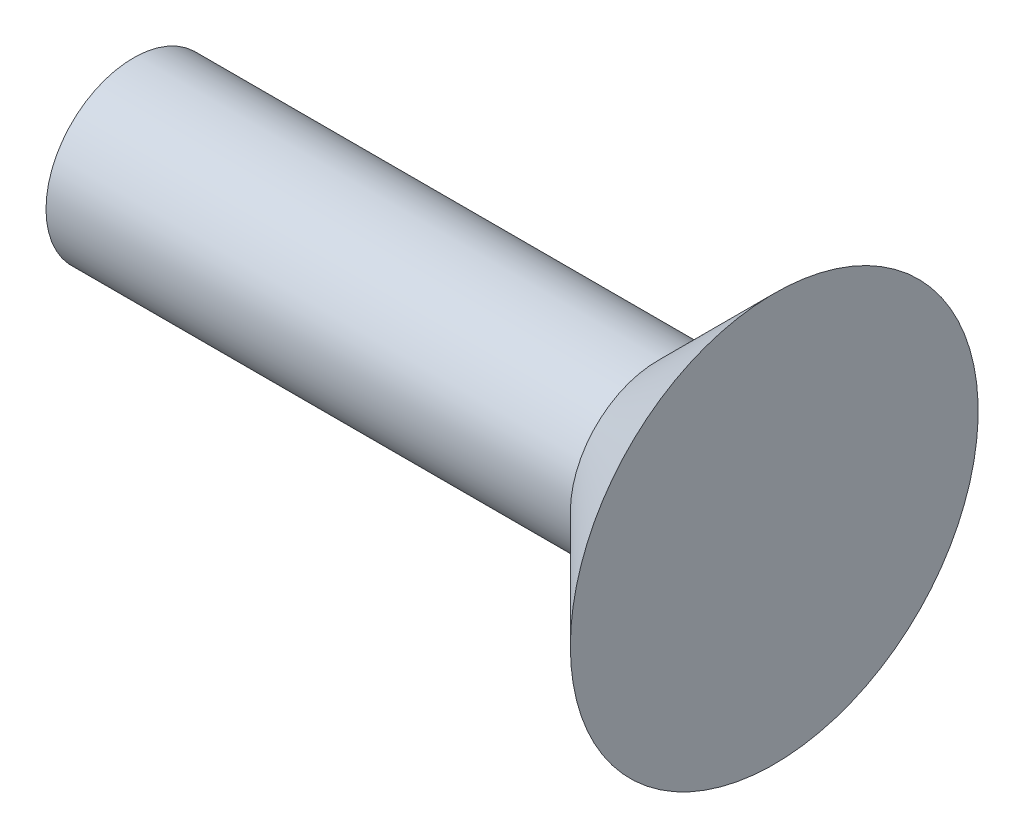
from build123d import *

# Parameters (mm, degrees)
SKETCH2_W          = 4.01503839
SKETCH2_H          = 3.611613481
CUT_EXTRUDE1_DEPTH = 3


with BuildPart() as part:
    # Sketch1 → Revolve2 (revolve)
    with BuildSketch(Plane.XY, mode=Mode.PRIVATE) as revolve2_sk:
        Polygon((-84.003233386, 19.234385214), (-72.003233386, 19.234385214), (-70.003233386, 21.234385214), (-70.003233386, 17.734385214), (-84.003233386, 17.734385214), align=None)
    revolve(revolve2_sk.sketch.rotate(Axis((-84.003233386, 17.734385214, 0), (1, 0, 0)), 90), axis=Axis((-84.003233386, 17.734385214, 0), (1, 0, 0)))

    # Sketch2 → Cut-Extrude1 (cut)
    with BuildSketch(Plane.ZY.offset(84.003233386)):
        with Locations((-0.220923165, 17.91688696)):
            Rectangle(SKETCH2_W, SKETCH2_H)
    extrude(amount=-CUT_EXTRUDE1_DEPTH, mode=Mode.SUBTRACT)


solid = part.part
